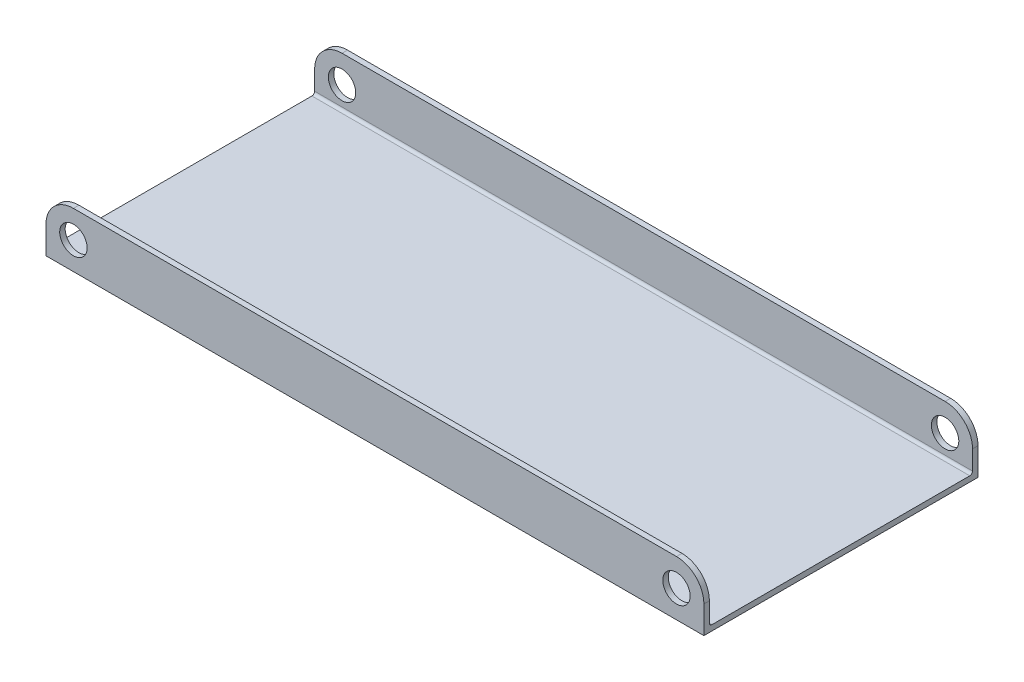
from build123d import *

# Parameters (mm, degrees)
SKETCH1_W           = 152.4
SKETCH1_H           = 63.5
BOSS_EXTRUDE1_DEPTH = 12.7
SKETCH2_W           = 152.4
SKETCH2_H           = 60.96
CUT_EXTRUDE1_DEPTH  = 11.43
SKETCH3_R           = 3.175
CUT_EXTRUDE2_DEPTH  = 100.9999
FILLET1_R           = 0.635


with BuildPart() as part:
    # Sketch1 → Boss-Extrude1 (new body)
    with BuildSketch(Plane(origin=(0, 0, 0), x_dir=(1, 0, 0), z_dir=(0, 1, 0))):
        Rectangle(SKETCH1_W, SKETCH1_H)
    extrude(amount=BOSS_EXTRUDE1_DEPTH)

    # Sketch2 → Cut-Extrude1 (cut)
    with BuildSketch(Plane(origin=(0, 12.7, 0), x_dir=(1, 0, 0), z_dir=(0, 1, 0))):
        Rectangle(SKETCH2_W, SKETCH2_H)
    extrude(amount=-CUT_EXTRUDE1_DEPTH, mode=Mode.SUBTRACT)

    # Sketch3 → Cut-Extrude2 (cut, through all)
    with BuildSketch(Plane.XY.offset(31.75)):
        with Locations((-69.85, 6.35)):
            Circle(SKETCH3_R)
        with BuildLine():
            ThreePointArc((-76.2, 6.35), (-74.340128061, 10.840128061), (-69.85, 12.7))
            Line((-69.85, 12.7), (-76.2, 12.7))
            Line((-76.2, 12.7), (-76.2, 6.35))
        make_face()
        with Locations((69.85, 6.35)):
            Circle(SKETCH3_R)
        with BuildLine():
            Line((76.2, 12.7), (69.85, 12.7))
            ThreePointArc((69.85, 12.7), (74.340128061, 10.840128061), (76.2, 6.35))
            Line((76.2, 6.35), (76.2, 12.7))
        make_face()
    extrude(amount=-CUT_EXTRUDE2_DEPTH, mode=Mode.SUBTRACT)

    # Fillet1
    fillet1_edges = [part.edges().sort_by_distance(p)[0] for p in [
        (0, 1.27, 30.48),
        (0, 1.27, -30.48),
    ]]
    fillet(fillet1_edges, radius=FILLET1_R)


solid = part.part
